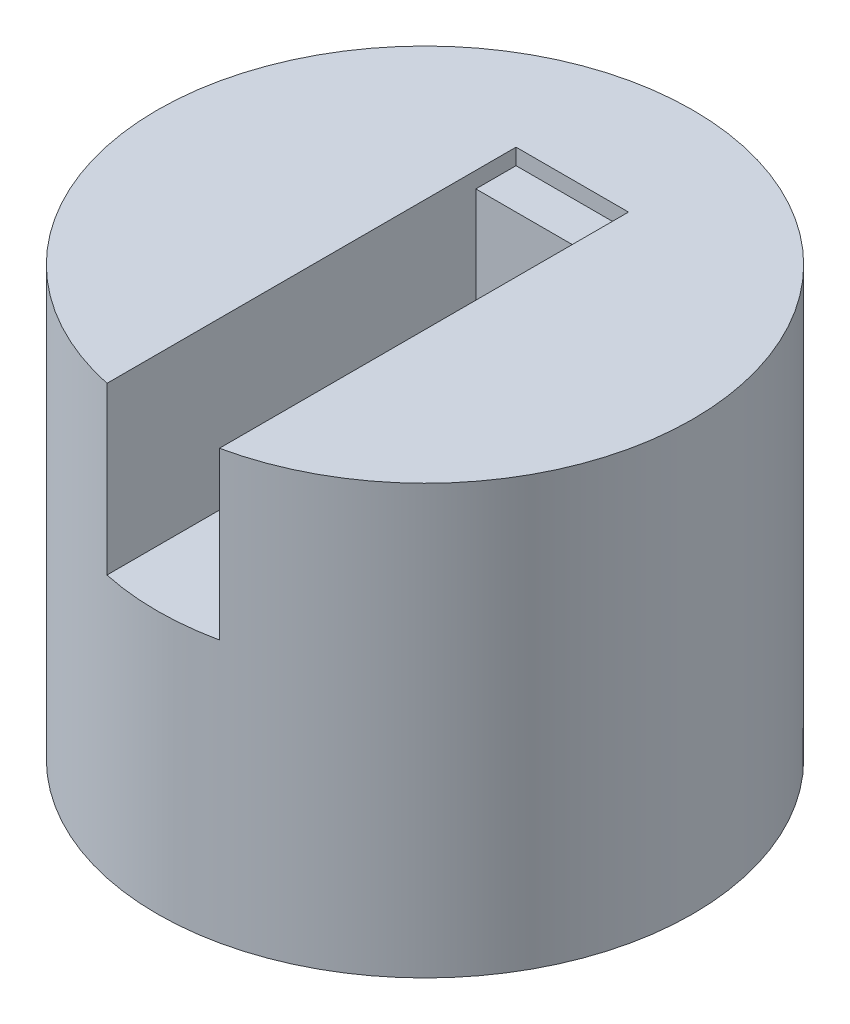
from build123d import *

# Parameters (mm, degrees)
SKETCH2_R           = 50
BOSS_EXTRUDE1_DEPTH = 80
SKETCH3_W           = 21
SKETCH3_H           = 55
CUT_EXTRUDE2_DEPTH  = 3
SKETCH4_W           = 21
SKETCH4_H           = 40
CUT_EXTRUDE3_DEPTH  = 28
SKETCH5_W           = 21
SKETCH5_H           = 56.862422016
CUT_EXTRUDE4_DEPTH  = 31


with BuildPart() as part:
    # Sketch2 → Boss-Extrude1 (new body)
    with BuildSketch(Plane(origin=(0, 0, 0), x_dir=(1, 0, 0), z_dir=(0, 1, 0))):
        with Locations(Location((0, 0, 0), (0, 0, 270))):
            Circle(SKETCH2_R)
    extrude(amount=BOSS_EXTRUDE1_DEPTH)

    # Sketch3 → Cut-Extrude2 (cut)
    with BuildSketch(Plane(origin=(0, 80, 0), x_dir=(1, 0, 0), z_dir=(0, 1, 0))):
        Rectangle(SKETCH3_W, SKETCH3_H)
    extrude(amount=-CUT_EXTRUDE2_DEPTH, mode=Mode.SUBTRACT)

    # Sketch4 → Cut-Extrude3 (cut)
    with BuildSketch(Plane(origin=(0, 77, 0), x_dir=(1, 0, 0), z_dir=(0, 1, 0))):
        Rectangle(SKETCH4_W, SKETCH4_H)
    extrude(amount=-CUT_EXTRUDE3_DEPTH, mode=Mode.SUBTRACT)

    # Sketch5 → Cut-Extrude4 (cut)
    with BuildSketch(Plane(origin=(0, 80, 0), x_dir=(1, 0, 0), z_dir=(0, 1, 0))):
        with Locations((0, -28.431211008)):
            Rectangle(SKETCH5_W, SKETCH5_H)
    extrude(amount=-CUT_EXTRUDE4_DEPTH, mode=Mode.SUBTRACT)


solid = part.part
